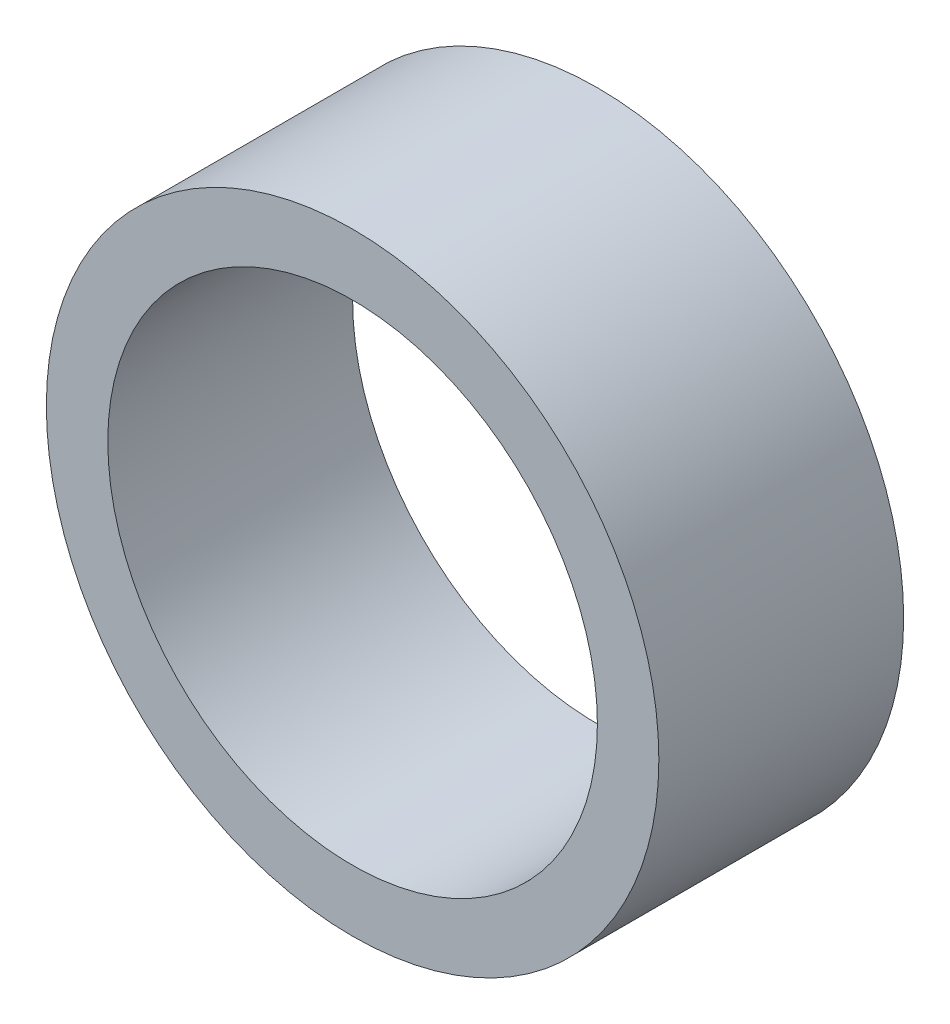
from build123d import *

# Parameters (mm, degrees)
SKETCH1_R      = 15.8877
SKETCH1_R_2    = 12.7
EXTRUDE1_DEPTH = 6.35


with BuildPart() as part:
    # Sketch1 → Extrude1 (new, symmetric)
    with BuildSketch(Plane.XY):
        Circle(SKETCH1_R)
        Circle(SKETCH1_R_2, mode=Mode.SUBTRACT)
    extrude(amount=EXTRUDE1_DEPTH, both=True)


solid = part.part
